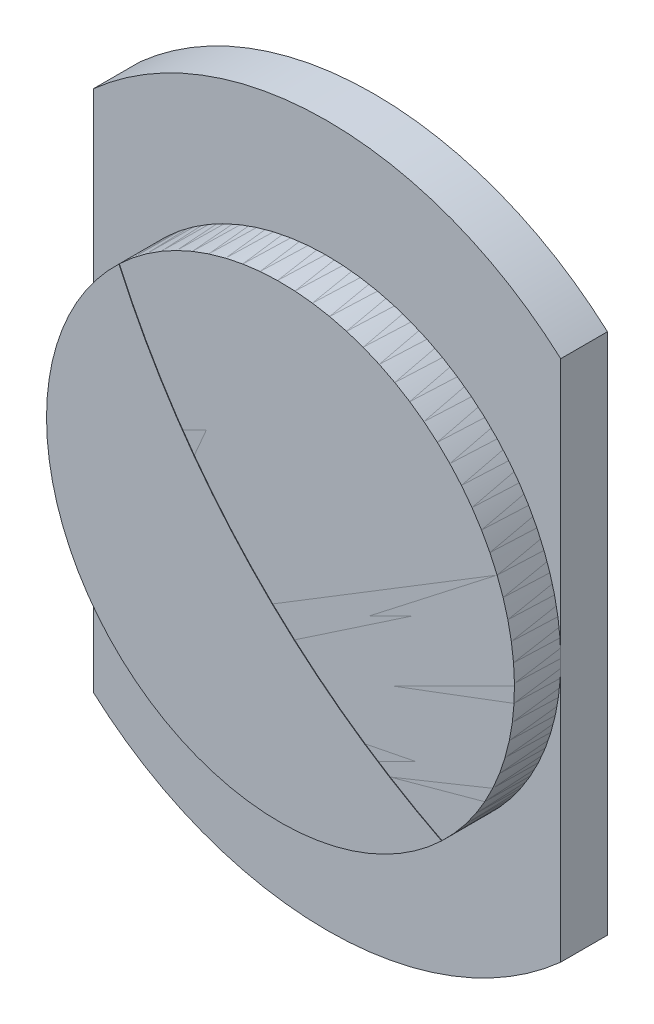
from build123d import *

# Parameters (mm, degrees)
SKETCH1_R           = 7.5
BOSS_EXTRUDE1_DEPTH = 1
SKETCH2_R           = 5
BOSS_EXTRUDE2_DEPTH = 1
CUT_EXTRUDE2_REACH  = 12.654
SKETCH4_R           = 15
CUT_EXTRUDE3_DEPTH  = 0.01
BOSS_EXTRUDE3_DEPTH = 1.99


with BuildPart() as part:
    # Sketch1 → Boss-Extrude1 (new body)
    with BuildSketch(Plane(origin=(0, 0, 0), x_dir=(0, 1, 0), z_dir=(0, 0, 1))):
        with Locations(Location((0, 0, 0), (0, 0, 270))):
            Circle(SKETCH1_R)
    extrude(amount=BOSS_EXTRUDE1_DEPTH)

    # Sketch2 → Boss-Extrude2 (add)
    with BuildSketch(Plane.XY.offset(1)):
        Circle(SKETCH2_R)
    extrude(amount=BOSS_EXTRUDE2_DEPTH)

    # Sketch3 → Cut-Extrude2 (cut, up to next)
    with BuildSketch(Plane.XY.offset(1), mode=Mode.PRIVATE) as cut_extrude2_sk1:
        with BuildLine():
            ThreePointArc((5, -5.590169944), (7.5, 0), (5, 5.590169944))
            Line((5, 5.590169944), (5, -5.590169944))
        make_face()
    cut_extrude2_tool1 = extrude(cut_extrude2_sk1.sketch, amount=-CUT_EXTRUDE2_REACH, mode=Mode.PRIVATE) & part.part
    # Sketch3 → Cut-Extrude2 (cut, up to next)
    with BuildSketch(Plane.XY.offset(1), mode=Mode.PRIVATE) as cut_extrude2_sk2:
        with BuildLine():
            Line((-5, -5.590169944), (-5, 5.590169944))
            ThreePointArc((-5, 5.590169944), (-7.5, 0), (-5, -5.590169944))
        make_face()
    cut_extrude2_tool2 = extrude(cut_extrude2_sk2.sketch, amount=-CUT_EXTRUDE2_REACH, mode=Mode.PRIVATE) & part.part
    add(cut_extrude2_tool1.solids().sort_by_distance((6.015822, 0, 1))[0], mode=Mode.SUBTRACT)
    add(cut_extrude2_tool2.solids().sort_by_distance((-6.015822, 0, 1))[0], mode=Mode.SUBTRACT)

    # Sketch4 → Cut-Extrude3 (cut)
    with BuildSketch(Plane(origin=(0, 0, 2), x_dir=(0, -1, 0), z_dir=(0, 0, 1))):
        with Locations((-9.760681966, 10.233723054)):
            Circle(SKETCH4_R)
    extrude(amount=-CUT_EXTRUDE3_DEPTH, mode=Mode.SUBTRACT)


with BuildPart() as body_2:
    # Sketch5 → Boss-Extrude3 (new body)
    with BuildSketch(Plane.XY.offset(1.99)):
        with BuildLine():
            ThreePointArc((3.450922204, -3.618167484), (3.618167484, 3.450922204), (-3.450922204, 3.618167484))
            ThreePointArc((-3.450922204, 3.618167484), (-0.620779398, -0.592084645), (3.450922204, -3.618167484))
        make_face()
    extrude(amount=-BOSS_EXTRUDE3_DEPTH)


solid = Compound([part.part, body_2.part])
